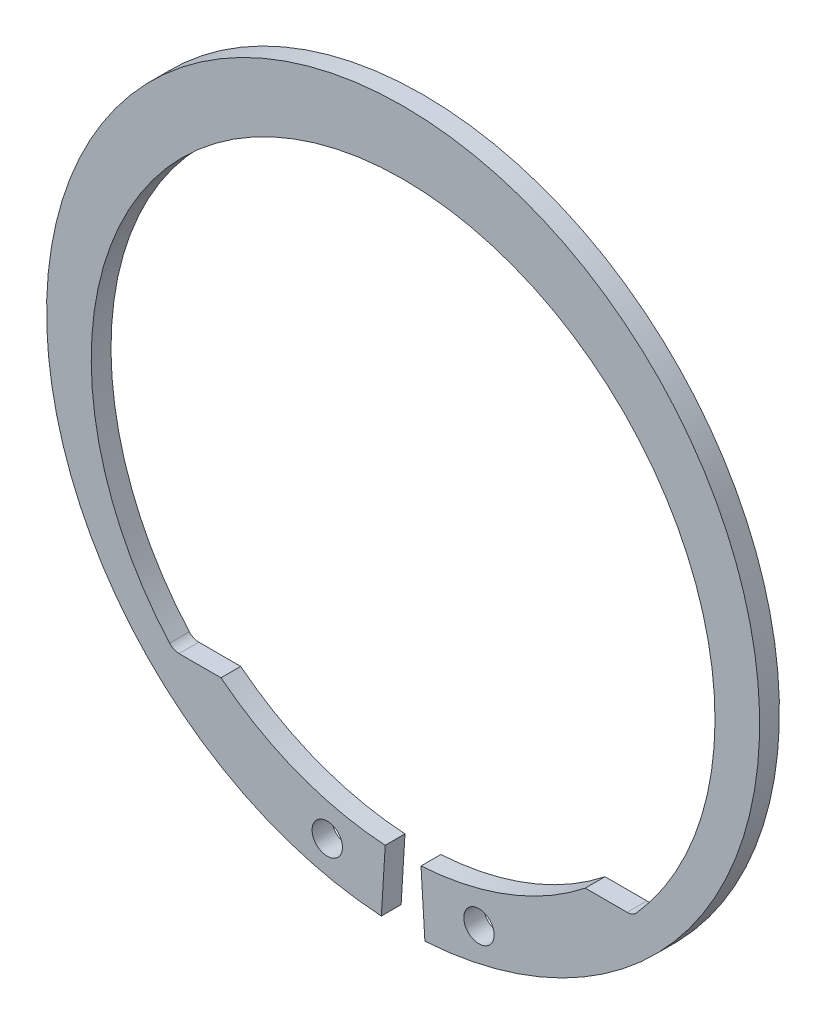
from build123d import *
from build123d.topology import SkipClean

# Parameters (mm, degrees)
SKETCH4_R           = 1.524
BOSS_EXTRUDE1_DEPTH = 0.9906
FILLET1_R           = 1.27


with BuildPart() as part:
    # Sketch4 → Boss-Extrude1 (new, symmetric)
    with BuildSketch(Plane.XY):
        with BuildLine():
            Line((-18.252177815, -23.016396438), (-23.016396438, -23.016396438))
            ThreePointArc((-23.016396438, -23.016396438), (-28.612162641, 10.693388458), (0, 29.3751))
            Line((0, 29.3751), (0, 35.7251))
            ThreePointArc((0, 35.7251), (-35.708437486, 1.090991438), (-2.18096518, -35.658465487))
            Line((-2.18096518, -35.658465487), (-1.793306954, -29.320309517))
            ThreePointArc((-1.793306954, -29.320309517), (-10.506673828, -27.431848371), (-18.252177815, -23.016396438))
        make_face()
        with Locations((-7.598669938, -31.650738146)):
            Circle(SKETCH4_R, mode=Mode.SUBTRACT)
    extrude(amount=BOSS_EXTRUDE1_DEPTH, both=True)

    # Fillet1
    fillet1_edges = [part.edges().sort_by_distance(p)[0] for p in [
        (-23.016396438, -23.016396438, 0),
    ]]
    fillet(fillet1_edges, radius=FILLET1_R)

    # Mirror1: part across plane


with BuildPart() as part_1:
    with SkipClean():  # the faces are left unmerged after this step: merging them gives an invalid solid
        add(part.part)
        add(part.part.mirror(Plane(origin=(0, 0, 0), x_dir=(0, 0, 1), z_dir=(1, 0, 0))))


solid = part_1.part
